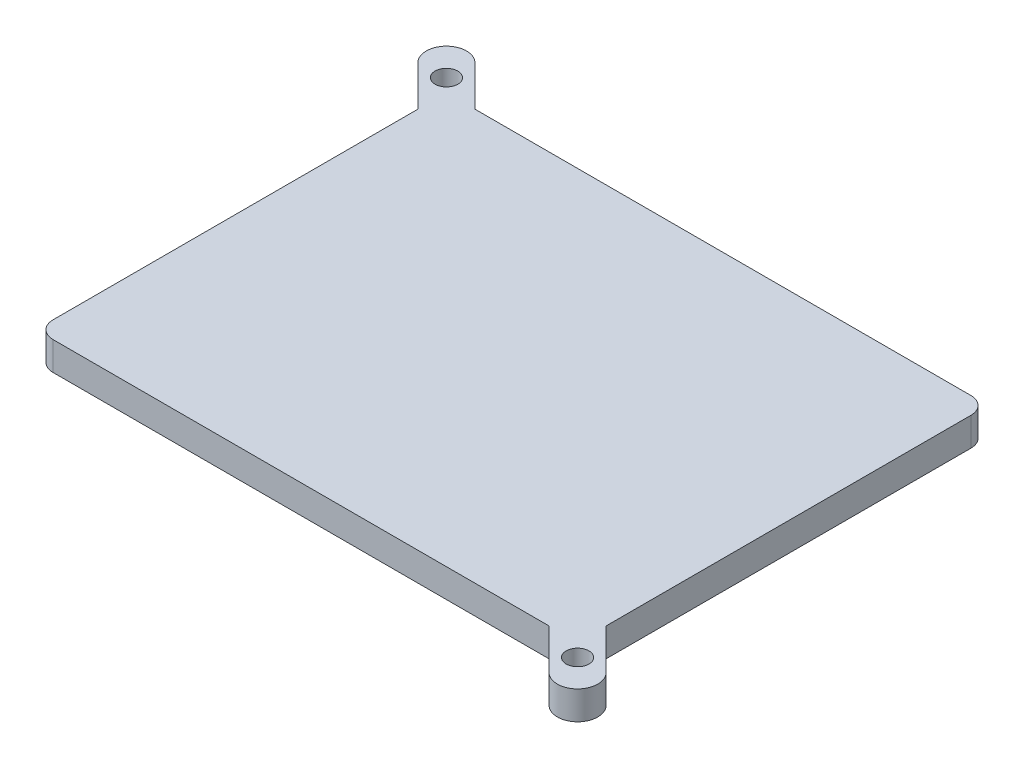
from build123d import *

# Parameters (mm, degrees)
ESBO_O1_R                = 2
RESSALTO_EXTRUS_O1_DEPTH = 5


with BuildPart() as part:
    # Esboço1 → Ressalto-extrusão1 (new body)
    # profile 1 of 2: a face of its own
    with BuildSketch(Plane(origin=(0, 0, 0), x_dir=(1, 0, 0), z_dir=(0, 1, 0))):
        with BuildLine():
            Line((9.016735984, -20.218643644), (16.087803796, -27.289711456))
            ThreePointArc((16.087803796, -27.289711456), (21.087803796, -27.289711456), (21.087803796, -22.289711456))
            Line((21.087803796, -22.289711456), (14.016735984, -15.218643644))
            Line((14.016735984, -15.218643644), (14.016735984, 48.781356356))
            ThreePointArc((14.016735984, 48.781356356), (13.138056327, 50.902676699), (11.016735984, 51.781356356))
            Line((11.016735984, 51.781356356), (-75.983264016, 51.781356356))
            Line((-75.983264016, 51.781356356), (-80.983264016, 46.781356356))
            Line((-80.983264016, 46.781356356), (-80.983264016, -17.218643644))
            ThreePointArc((-80.983264016, -17.218643644), (-80.10458436, -19.339963988), (-77.983264016, -20.218643644))
            Line((-77.983264016, -20.218643644), (9.016735984, -20.218643644))
        make_face()
        with Locations(Location((16.30226989, -22.50417755, 0), (0, 0, 270))):
            Circle(ESBO_O1_R, mode=Mode.SUBTRACT)
    # profile 2 of 2: a face of its own
    with BuildSketch(Plane(origin=(0, 0, 0), x_dir=(1, 0, 0), z_dir=(0, 1, 0))):
        with BuildLine():
            Line((-75.983264016, 51.781356356), (-83.054331828, 58.852424167))
            ThreePointArc((-83.054331828, 58.852424167), (-88.054331828, 58.852424167), (-88.054331828, 53.852424167))
            Line((-88.054331828, 53.852424167), (-80.983264016, 46.781356356))
            Line((-80.983264016, 46.781356356), (-75.983264016, 51.781356356))
        make_face()
        with Locations(Location((-83.268797922, 54.066890262, 0), (0, 0, 270))):
            Circle(ESBO_O1_R, mode=Mode.SUBTRACT)
    extrude(amount=RESSALTO_EXTRUS_O1_DEPTH)


solid = part.part
